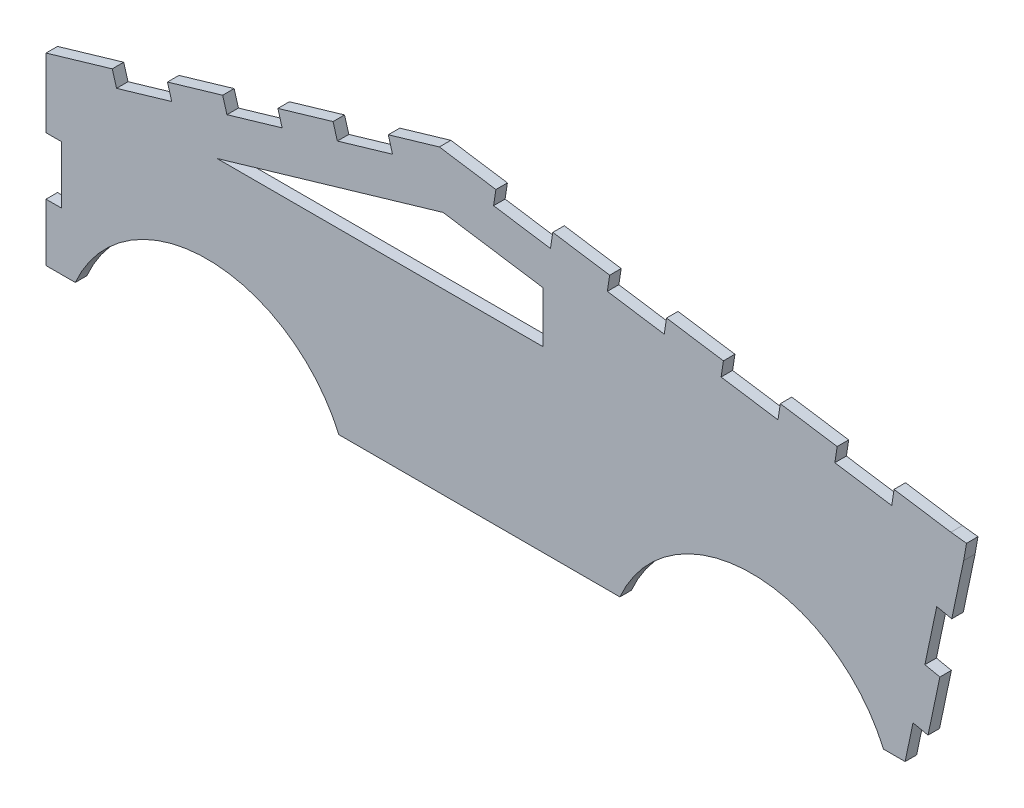
from build123d import *

# Parameters (mm, degrees)
BOSS_EXTRUDE1_DEPTH = 3
SKETCH2_R           = 37.5
CUT_EXTRUDE1_DEPTH  = 3
SKETCH3_W           = 4
SKETCH3_H           = 15
BOSS_EXTRUDE4_DEPTH = 3


with BuildPart() as part:
    # Sketch1 → Boss-Extrude1 (new body)
    with BuildSketch(Plane.XY):
        Polygon((11.337032692, 53.818878563), (0, 0), (-220, 0), (-220, 45), (-121.162967308, 73.986910298), align=None)
        Polygon((-94.409209541, 46.483265917), (-94.409209541, 59.799500594), (-120.476048116, 63.767174765), (-179.409209541, 46.483265917), align=None, mode=Mode.SUBTRACT)
    extrude(amount=-BOSS_EXTRUDE1_DEPTH)

    # Sketch2 → Cut-Extrude1 (cut)
    with BuildSketch(Plane.XY):
        with Locations((-182, -15)):
            Circle(SKETCH2_R)
        with Locations((-40, -15)):
            Circle(SKETCH2_R)
    extrude(amount=-CUT_EXTRUDE1_DEPTH, mode=Mode.SUBTRACT)

    # Sketch3 → Boss-Extrude4 (add)
    with BuildSketch(Plane.XY):
        Polygon((-206.731962629, 53.05972607), (-205.606257375, 49.221394704), (-220, 45), (-220, 30), (-224, 30), (-224, 45), (-224, 47.99535863), (-221.125705254, 48.838331367), align=None)
        Polygon((-192.338220004, 57.281120774), (-191.21251475, 53.442789407), (-176.818772125, 57.664184111), (-177.944477379, 61.502515478), align=None)
        Polygon((-121.437734985, 78.074804512), (-106.694649955, 75.830736536), (-107.296563448, 71.876283331), (-121.162967308, 73.986910298), (-133.63754425, 70.328368222), (-134.763249504, 74.166699588), align=None)
        Polygon((-77.03625092, 71.316385344), (-77.638164413, 67.361932139), (-92.46736393, 69.619107735), (-91.865450438, 73.57356094), align=None)
        Polygon((-3.492166825, 56.076054159), (-2.890253333, 60.030507363), (11.938946184, 57.773331767), (16.003099334, 57.297974706), (15.251132951, 52.994367094), (12.159214944, 38.316491123), (8.245114685, 39.141002591), (11.337032692, 53.818878563), align=None)
        Polygon((-18.321366343, 58.333229755), (-17.719452851, 62.287682959), (-32.548652368, 64.544858556), (-33.15056586, 60.590405351), align=None)
        Polygon((-163.550734754, 65.723910181), (-162.4250295, 61.885578815), (-148.031286875, 66.106973518), (-149.156992129, 69.945304885), align=None)
        Polygon((-47.979765378, 62.847580947), (-47.377851886, 66.802034152), (-62.207051403, 69.059209748), (-62.808964895, 65.104756543), align=None)
        with Locations((-222, 7.5)):
            Rectangle(SKETCH3_W, SKETCH3_H)
        Polygon((5.153196678, 24.463126619), (9.067296937, 23.638615151), (5.97537893, 8.960739179), (2.061278671, 9.785250648), align=None)
    extrude(amount=-BOSS_EXTRUDE4_DEPTH)


solid = part.part
